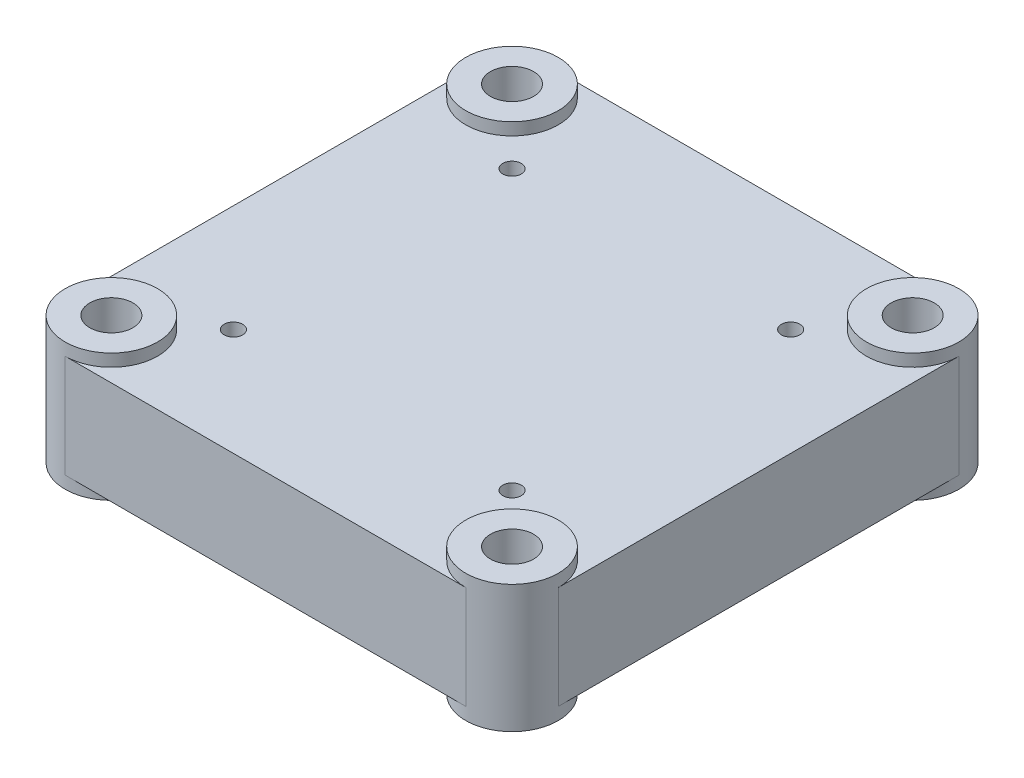
from build123d import *
from build123d.topology import SkipClean

# Parameters (mm, degrees)
SKETCH1_R           = 3.5
SKETCH1_R_2         = 1.5
BOSS_EXTRUDE1_DEPTH = 16.7
SKETCH4_R           = 7.5
SKETCH4_R_2         = 3.5
BOSS_EXTRUDE5_DEPTH = 2
SKETCH5_R           = 17.4
BOSS_EXTRUDE7_DEPTH = 8
BOSS_EXTRUDE8_START = -18.7
SKETCH4_2_R         = 7.5
SKETCH4_2_R_2       = 3.5
BOSS_EXTRUDE8_DEPTH = 2


with BuildPart() as part:
    # Sketch1 → Boss-Extrude1 (new body)
    with BuildSketch(Plane(origin=(0, 0, 0), x_dir=(1, 0, 0), z_dir=(0, 1, 0))):
        with BuildLine():
            Line((-32.5, -40), (32.5, -40))
            ThreePointArc((32.5, -40), (37.803300859, -37.803300859), (40, -32.5))
            Line((40, -32.5), (40, 32.5))
            ThreePointArc((40, 32.5), (37.803300859, 37.803300859), (32.5, 40))
            Line((32.5, 40), (-32.5, 40))
            ThreePointArc((-32.5, 40), (-37.803300859, 37.803300859), (-40, 32.5))
            Line((-40, 32.5), (-40, -32.5))
            ThreePointArc((-40, -32.5), (-37.803300859, -37.803300859), (-32.5, -40))
        make_face()
        with Locations(Location((32.5, 32.5, 0), (0, 0, 270))):
            Circle(SKETCH1_R, mode=Mode.SUBTRACT)
        with Locations(Location((-32.5, -32.5, 0), (0, 0, 90))):
            Circle(SKETCH1_R, mode=Mode.SUBTRACT)
        with Locations(Location((-32.5, 32.5, 0), (0, 0, 90))):
            Circle(SKETCH1_R, mode=Mode.SUBTRACT)
        with Locations(Location((32.5, -32.5, 0), (0, 0, 270))):
            Circle(SKETCH1_R, mode=Mode.SUBTRACT)
        with Locations(Location((22.600505063, -22.600505063, 0), (0, 0, 270))):
            Circle(SKETCH1_R_2, mode=Mode.SUBTRACT)
        with Locations(Location((-22.600505063, -22.600505063, 0), (0, 0, 90))):
            Circle(SKETCH1_R_2, mode=Mode.SUBTRACT)
        with Locations(Location((-22.600505063, 22.600505063, 0), (0, 0, 270))):
            Circle(SKETCH1_R_2, mode=Mode.SUBTRACT)
        with Locations(Location((22.600505063, 22.600505063, 0), (0, 0, 90))):
            Circle(SKETCH1_R_2, mode=Mode.SUBTRACT)
    extrude(amount=BOSS_EXTRUDE1_DEPTH)

    # Sketch4 → Boss-Extrude5 (add)
    # profile 1 of 4: a face of its own
    with BuildSketch(Plane(origin=(0, 16.7, 0), x_dir=(1, 0, 0), z_dir=(0, 1, 0))):
        with Locations(Location((32.5, 32.5, 0), (0, 0, 90))):
            Circle(SKETCH4_R)
        with Locations(Location((32.5, 32.5, 0), (0, 0, 90))):
            Circle(SKETCH4_R_2, mode=Mode.SUBTRACT)
    # profile 2 of 4: a face of its own
    with BuildSketch(Plane(origin=(0, 16.7, 0), x_dir=(1, 0, 0), z_dir=(0, 1, 0))):
        with Locations(Location((32.5, -32.5, 0), (0, 0, 90))):
            Circle(SKETCH4_R)
        with Locations(Location((32.5, -32.5, 0), (0, 0, 90))):
            Circle(SKETCH4_R_2, mode=Mode.SUBTRACT)
    # profile 3 of 4: a face of its own
    with BuildSketch(Plane(origin=(0, 16.7, 0), x_dir=(1, 0, 0), z_dir=(0, 1, 0))):
        with Locations(Location((-32.5, -32.5, 0), (0, 0, 90))):
            Circle(SKETCH4_R)
        with Locations(Location((-32.5, -32.5, 0), (0, 0, 90))):
            Circle(SKETCH4_R_2, mode=Mode.SUBTRACT)
    # profile 4 of 4: a face of its own
    with BuildSketch(Plane(origin=(0, 16.7, 0), x_dir=(1, 0, 0), z_dir=(0, 1, 0))):
        with Locations(Location((-32.5, 32.5, 0), (0, 0, 90))):
            Circle(SKETCH4_R)
        with Locations(Location((-32.5, 32.5, 0), (0, 0, 90))):
            Circle(SKETCH4_R_2, mode=Mode.SUBTRACT)
    extrude(amount=BOSS_EXTRUDE5_DEPTH)

    # Sketch5 → Boss-Extrude7 (add)
    with BuildSketch(Plane.XZ):
        with Locations(Location((0, 0, 0), (0, 0, 270))):
            Circle(SKETCH5_R)
    extrude(amount=BOSS_EXTRUDE7_DEPTH)

    # Sketch4<2> → Boss-Extrude8 (add)
    # profile 1 of 4: a face of its own
    with SkipClean():  # the faces are left unmerged after this step: merging them gives an invalid solid
        with BuildSketch(Plane(origin=(0, 16.7, 0), x_dir=(1, 0, 0), z_dir=(0, 1, 0)).offset(BOSS_EXTRUDE8_START)):
            with Locations(Location((32.5, 32.5, 0), (0, 0, 90))):
                Circle(SKETCH4_2_R)
            with Locations(Location((32.5, 32.5, 0), (0, 0, 90))):
                Circle(SKETCH4_2_R_2, mode=Mode.SUBTRACT)
        # profile 2 of 4: a face of its own
        with BuildSketch(Plane(origin=(0, 16.7, 0), x_dir=(1, 0, 0), z_dir=(0, 1, 0)).offset(BOSS_EXTRUDE8_START)):
            with Locations(Location((32.5, -32.5, 0), (0, 0, 90))):
                Circle(SKETCH4_2_R)
            with Locations(Location((32.5, -32.5, 0), (0, 0, 90))):
                Circle(SKETCH4_2_R_2, mode=Mode.SUBTRACT)
        # profile 3 of 4: a face of its own
        with BuildSketch(Plane(origin=(0, 16.7, 0), x_dir=(1, 0, 0), z_dir=(0, 1, 0)).offset(BOSS_EXTRUDE8_START)):
            with Locations(Location((-32.5, -32.5, 0), (0, 0, 90))):
                Circle(SKETCH4_2_R)
            with Locations(Location((-32.5, -32.5, 0), (0, 0, 90))):
                Circle(SKETCH4_2_R_2, mode=Mode.SUBTRACT)
        # profile 4 of 4: a face of its own
        with BuildSketch(Plane(origin=(0, 16.7, 0), x_dir=(1, 0, 0), z_dir=(0, 1, 0)).offset(BOSS_EXTRUDE8_START)):
            with Locations(Location((-32.5, 32.5, 0), (0, 0, 90))):
                Circle(SKETCH4_2_R)
            with Locations(Location((-32.5, 32.5, 0), (0, 0, 90))):
                Circle(SKETCH4_2_R_2, mode=Mode.SUBTRACT)
        extrude(amount=BOSS_EXTRUDE8_DEPTH)


solid = part.part
